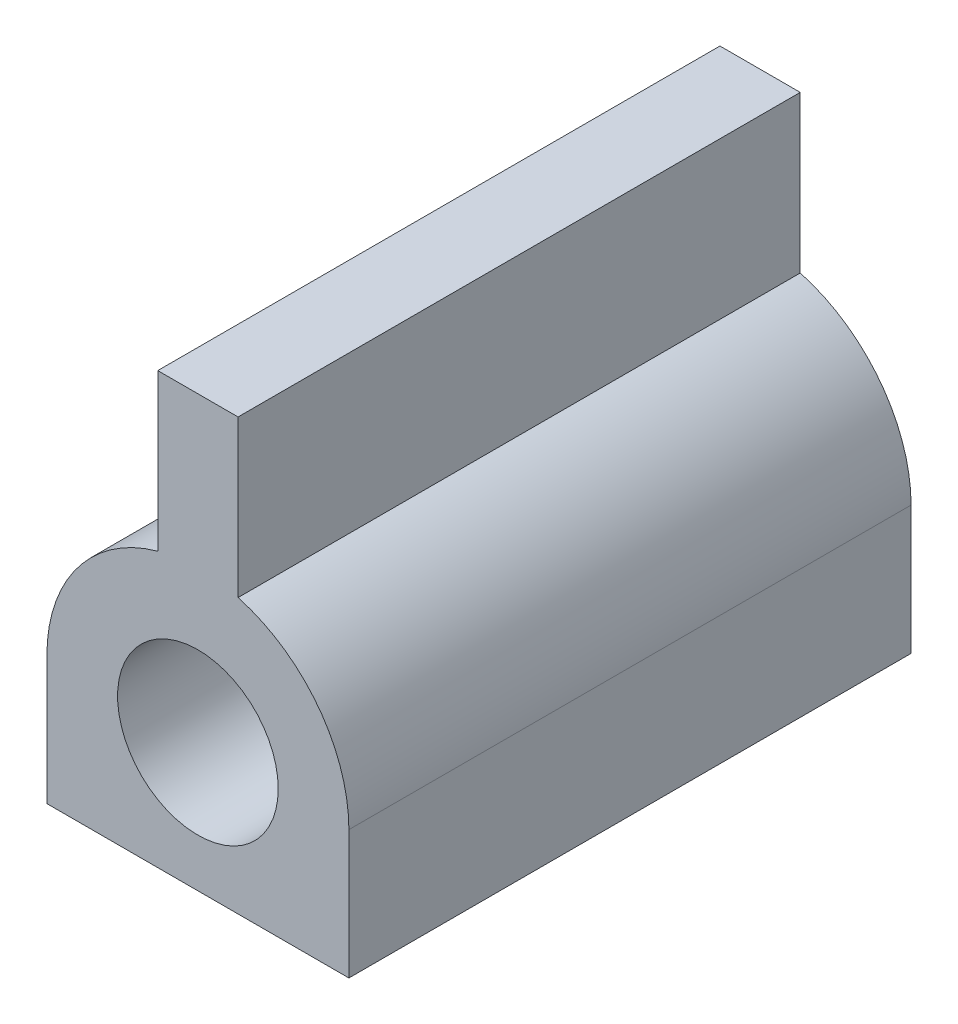
from build123d import *

# Parameters (mm, degrees)
SKETCH1_R           = 6.35
BOSS_EXTRUDE1_DEPTH = 22.225


with BuildPart() as part:
    # Sketch1 → Boss-Extrude1 (new, symmetric)
    with BuildSketch(Plane.XY):
        with BuildLine():
            Line((11.938, -10.16), (-11.938, -10.16))
            Line((-11.938, -10.16), (-11.938, 0))
            ThreePointArc((-11.938, 0), (-9.497868024, 7.232312701), (-3.175, 11.508050182))
            Line((-3.175, 11.508050182), (-3.175, 23.876))
            Line((-3.175, 23.876), (3.175, 23.876))
            Line((3.175, 23.876), (3.175, 11.508050182))
            ThreePointArc((3.175, 11.508050182), (9.497868024, 7.232312701), (11.938, 0))
            Line((11.938, 0), (11.938, -10.16))
        make_face()
        Circle(SKETCH1_R, mode=Mode.SUBTRACT)
    extrude(amount=BOSS_EXTRUDE1_DEPTH, both=True)


solid = part.part
